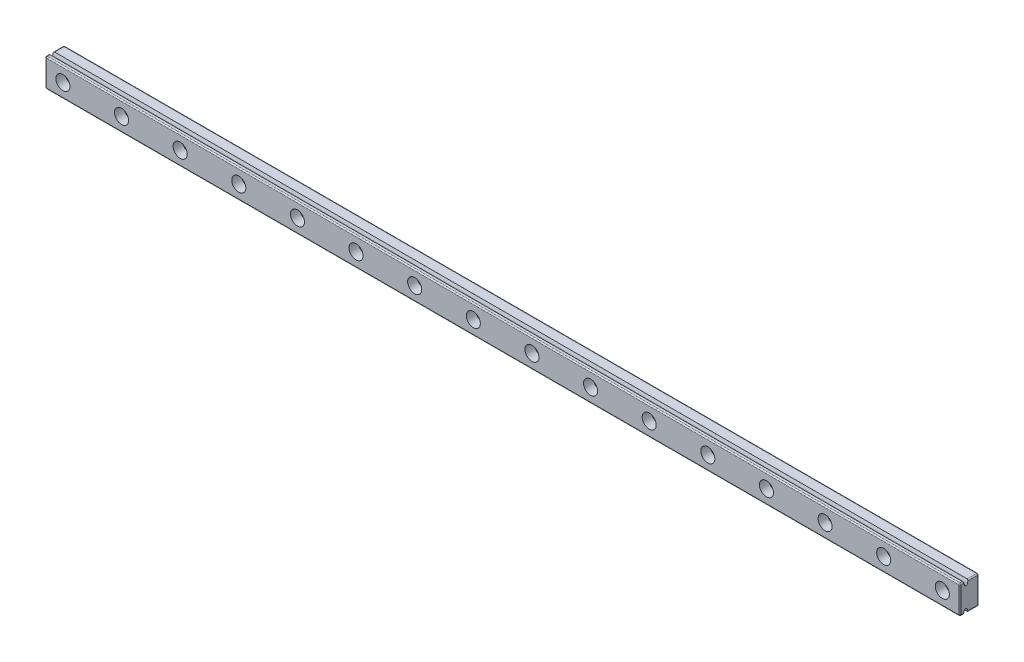
from build123d import *
from OCP.BRepFilletAPI import BRepFilletAPI_MakeChamfer

# Parameters (mm, degrees)
BOSS_EXTRUDE1_DEPTH = 390
SKETCH2_R           = 1.75
CUT_EXTRUDE1_DEPTH  = 10
SKETCH3_R           = 3
CUT_EXTRUDE2_DEPTH  = 4
CHAMFER1_SIZE       = 0.5
CHAMFER1_SIZE2      = 1.743707222
FILLET1_R           = 0.5


with BuildPart() as part:
    # Sketch1 → Boss-Extrude1 (new body)
    with BuildSketch(Plane(origin=(0, 0, 0), x_dir=(0, 0, -1), z_dir=(1, 0, 0))):
        Polygon((-0.5, 6), (4, 6), (4, -6), (-0.5, -6), (-0.5, -4.25), (-2.5, -4.25), (-2.5, -6), (-4, -6), (-4, 6), (-2.5, 6), (-2.5, 4.25), (-0.5, 4.25), align=None)
    extrude(amount=BOSS_EXTRUDE1_DEPTH)

    # Sketch2 → Cut-Extrude1 (cut)
    with BuildSketch(Plane.XY.offset(4)):
        with Locations((7.5, 0)):
            Circle(SKETCH2_R)
        with Locations((32.5, 0)):
            Circle(SKETCH2_R)
        with Locations((57.5, 0)):
            Circle(SKETCH2_R)
        with Locations((82.5, 0)):
            Circle(SKETCH2_R)
        with Locations((107.5, 0)):
            Circle(SKETCH2_R)
        with Locations((132.5, 0)):
            Circle(SKETCH2_R)
        with Locations((157.5, 0)):
            Circle(SKETCH2_R)
        with Locations((182.5, 0)):
            Circle(SKETCH2_R)
        with Locations((207.5, 0)):
            Circle(SKETCH2_R)
        with Locations((232.5, 0)):
            Circle(SKETCH2_R)
        with Locations((257.5, 0)):
            Circle(SKETCH2_R)
        with Locations((282.5, 0)):
            Circle(SKETCH2_R)
        with Locations((307.5, 0)):
            Circle(SKETCH2_R)
        with Locations((332.5, 0)):
            Circle(SKETCH2_R)
        with Locations((357.5, 0)):
            Circle(SKETCH2_R)
        with Locations((382.5, 0)):
            Circle(SKETCH2_R)
    extrude(amount=-CUT_EXTRUDE1_DEPTH, mode=Mode.SUBTRACT)

    # Sketch3 → Cut-Extrude2 (cut)
    with BuildSketch(Plane.XY.offset(4)):
        with Locations((7.5, 0)):
            Circle(SKETCH3_R)
        with Locations((32.5, 0)):
            Circle(SKETCH3_R)
        with Locations((57.5, 0)):
            Circle(SKETCH3_R)
        with Locations((82.5, 0)):
            Circle(SKETCH3_R)
        with Locations((107.5, 0)):
            Circle(SKETCH3_R)
        with Locations((132.5, 0)):
            Circle(SKETCH3_R)
        with Locations((157.5, 0)):
            Circle(SKETCH3_R)
        with Locations((182.5, 0)):
            Circle(SKETCH3_R)
        with Locations((207.5, 0)):
            Circle(SKETCH3_R)
        with Locations((232.5, 0)):
            Circle(SKETCH3_R)
        with Locations((257.5, 0)):
            Circle(SKETCH3_R)
        with Locations((282.5, 0)):
            Circle(SKETCH3_R)
        with Locations((307.5, 0)):
            Circle(SKETCH3_R)
        with Locations((332.5, 0)):
            Circle(SKETCH3_R)
        with Locations((357.5, 0)):
            Circle(SKETCH3_R)
        with Locations((382.5, 0)):
            Circle(SKETCH3_R)
    extrude(amount=-CUT_EXTRUDE2_DEPTH, mode=Mode.SUBTRACT)

    # Chamfer1: one chamfer whose edges measure the first distance from different faces: ONE call of the kernel's chamfer builder (chamfer() names one face for all edges)
    chamfer1_edges_1 = [part.edges().sort_by_distance(p)[0] for p in [
        (195, -4.25, 0.5),
        (195, -4.25, 2.5),
    ]]
    chamfer1_side_1 = [part.faces().sort_by_distance(p)[0] for p in [
        (195, -4.25, 1.5),
    ]]
    chamfer1_edges_2 = [part.edges().sort_by_distance(p)[0] for p in [
        (195, 4.25, 2.5),
        (195, 4.25, 0.5),
    ]]
    chamfer1_side_2 = [part.faces().sort_by_distance(p)[0] for p in [
        (195, 4.25, 1.5),
    ]]
    chamfer1 = BRepFilletAPI_MakeChamfer(part.part.solid().wrapped)
    for e in chamfer1_edges_1:
        chamfer1.Add(CHAMFER1_SIZE, CHAMFER1_SIZE2, e.wrapped, chamfer1_side_1[0].wrapped)  # the first distance lies on this face
    for e in chamfer1_edges_2:
        chamfer1.Add(CHAMFER1_SIZE, CHAMFER1_SIZE2, e.wrapped, chamfer1_side_2[0].wrapped)  # the first distance lies on this face
    add(Compound.cast(chamfer1.Shape()), mode=Mode.REPLACE)

    # Fillet1
    fillet1_edges = [part.edges().sort_by_distance(p)[0] for p in [
        (390, -6, -1.75),
        (390, 0, -4),
        (390, 6, -1.75),
        (390, 6, 3.25),
        (390, 0, 4),
        (390, -6, 3.25),
        (0, -6, 3.25),
        (0, -6, -1.75),
        (0, 0, -4),
        (0, 6, -1.75),
        (0, 6, 3.25),
        (0, 0, 4),
        (195, -4.25, 1),
        (195, -4.25, 2),
        (195, 4.25, 2),
        (195, 4.25, 1),
        (195, -6, 4),
        (195, 6, 4),
        (195, -6, -4),
        (195, 6, -4),
    ]]
    fillet(fillet1_edges, radius=FILLET1_R)


solid = part.part
